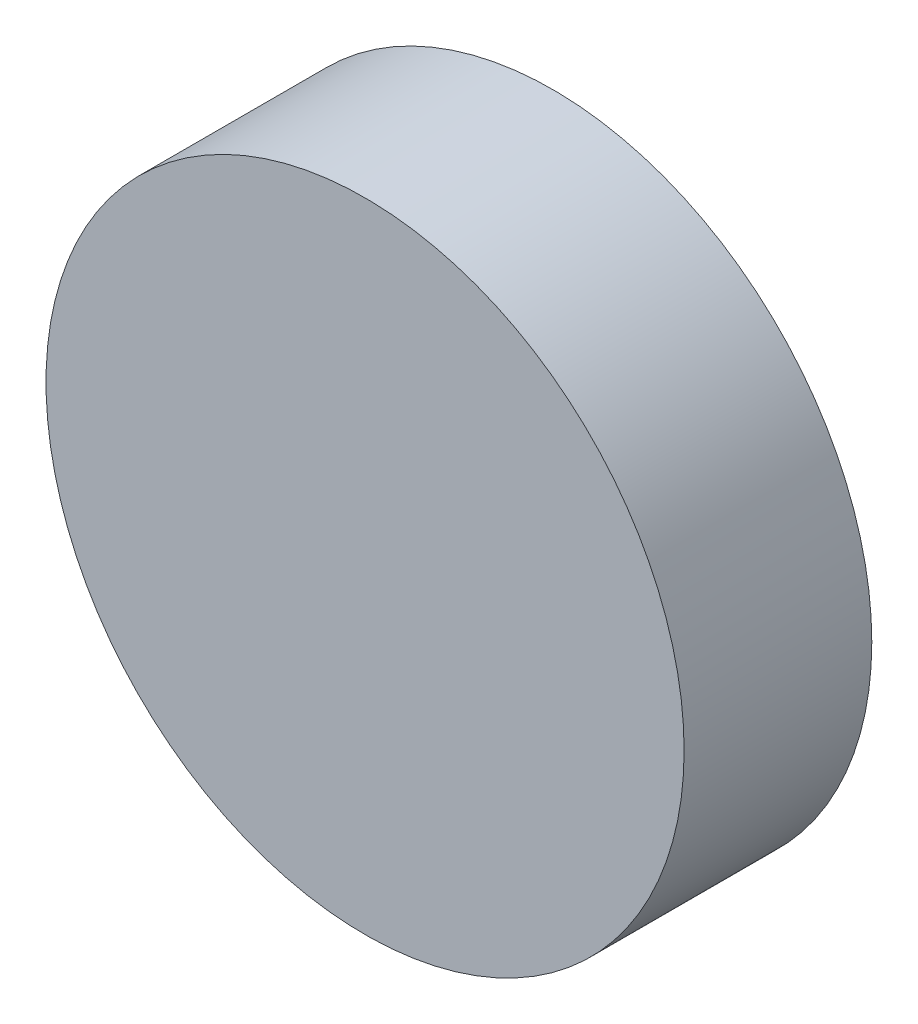
from build123d import *

# Parameters (mm, degrees)
SKETCH1_R           = 8.5
BOSS_EXTRUDE1_DEPTH = 5


with BuildPart() as part:
    # Sketch1 → Boss-Extrude1 (new body)
    with BuildSketch(Plane.XY):
        Circle(SKETCH1_R)
    extrude(amount=BOSS_EXTRUDE1_DEPTH)


solid = part.part
